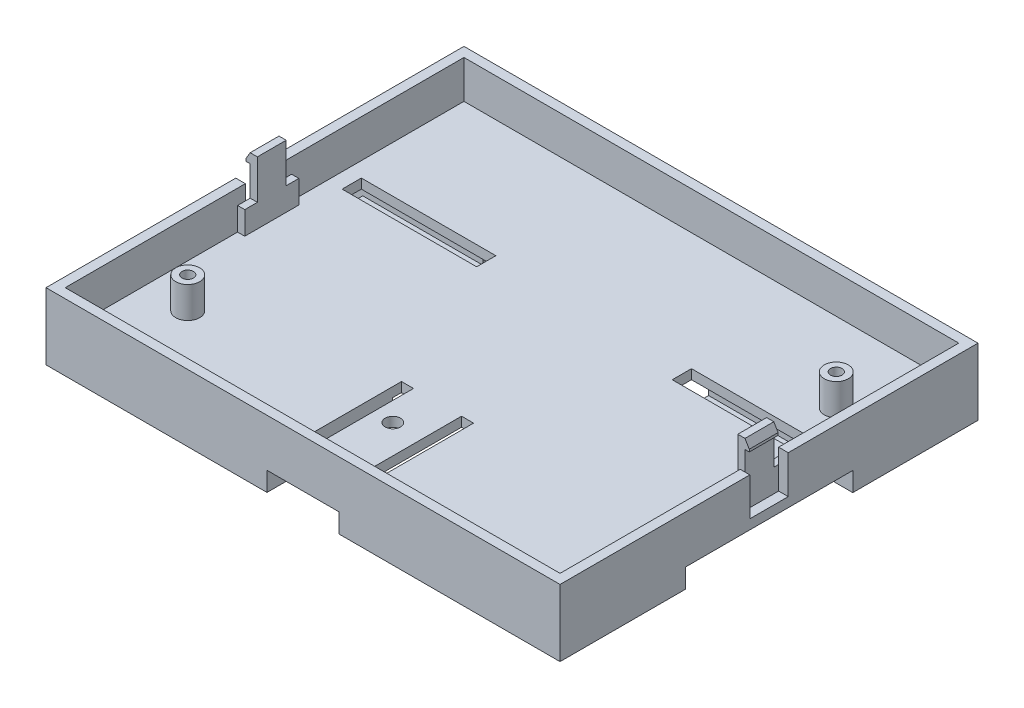
from build123d import *

# Parameters (mm, degrees)
SKETCH1_W               = 107
SKETCH1_H               = 87
BOSS_EXTRUDE1_DEPTH     = 13.92
SKETCH2_W               = 103
SKETCH2_H               = 83
CUT_EXTRUDE1_DEPTH      = 7.92
SKETCH3_R               = 2.5
BOSS_EXTRUDE2_DEPTH     = 6.5
CUT_EXTRUDE2_DEPTH      = 70.406241794
CUT_EXTRUDE2_DEPTH_BACK = 4
SKETCH4_R               = 1.2
SKETCH5_W               = 28
SKETCH5_H               = 4
CUT_EXTRUDE3_DEPTH      = 70.406241794
SKETCH6_W               = 2.5
SKETCH6_H               = 24
CUT_EXTRUDE4_DEPTH      = 70.406241794
SKETCH7_R               = 1.6
CUT_EXTRUDE6_DEPTH      = 70.406241794
SKETCH8_W               = 8
SKETCH8_H               = 7.92
CUT_EXTRUDE9_DEPTH      = 4
SKETCH9_W               = 1.5
SKETCH9_H               = 11.25
BOSS_EXTRUDE4_DEPTH     = 4.8
SKETCH10_W              = 1.5
SKETCH10_H              = 6
BOSS_EXTRUDE5_DEPTH     = 8.2
BOSS_EXTRUDE6_DEPTH     = 6
SKETCH12_W              = 103
SKETCH12_H              = 83
CUT_EXTRUDE10_DEPTH     = 4
SKETCH13_W              = 34.87
SKETCH13_H              = 4
CUT_EXTRUDE11_DEPTH     = 118.056610236
SKETCH14_W              = 28
SKETCH14_H              = 2.5
BOSS_EXTRUDE9_DEPTH     = 4
BOSS_EXTRUDE10_DEPTH    = 25
BOSS_EXTRUDE11_DEPTH    = 25
SKETCH16_W              = 15
SKETCH16_H              = 4
CUT_EXTRUDE12_DEPTH     = 104.885754558
BOSS_EXTRUDE12_DEPTH    = 4


with BuildPart() as part:
    # Sketch1 → Boss-Extrude1 (new body)
    with BuildSketch(Plane(origin=(0, 0, 0), x_dir=(1, 0, 0), z_dir=(0, 1, 0))):
        Rectangle(SKETCH1_W, SKETCH1_H)
    extrude(amount=BOSS_EXTRUDE1_DEPTH)

    # Sketch2 → Cut-Extrude1 (cut)
    with BuildSketch(Plane(origin=(0, 13.92, 0), x_dir=(1, 0, 0), z_dir=(0, 1, 0))):
        Rectangle(SKETCH2_W, SKETCH2_H)
    extrude(amount=-CUT_EXTRUDE1_DEPTH, mode=Mode.SUBTRACT)

    # Sketch3 → Boss-Extrude2 (add)
    with BuildSketch(Plane(origin=(0, 6, 0), x_dir=(1, 0, 0), z_dir=(0, 1, 0))):
        with Locations((-42.5, -25)):
            Circle(SKETCH3_R)
        with Locations((42.5, 25)):
            Circle(SKETCH3_R)
    extrude(amount=BOSS_EXTRUDE2_DEPTH)

    # Sketch4 → Cut-Extrude2 (cut, two sides: drawn at the far end of the back side and taken through both)
    with BuildSketch(Plane(origin=(0, 6, 0), x_dir=(1, 0, 0), z_dir=(0, 1, 0)).offset(-CUT_EXTRUDE2_DEPTH_BACK)):
        with Locations((-42.5, -25)):
            Circle(SKETCH4_R)
        with Locations((42.5, 25)):
            Circle(SKETCH4_R)
    extrude(amount=CUT_EXTRUDE2_DEPTH + CUT_EXTRUDE2_DEPTH_BACK, mode=Mode.SUBTRACT)

    # Sketch5 → Cut-Extrude3 (cut, through all)
    with BuildSketch(Plane(origin=(0, 6, 0), x_dir=(1, 0, 0), z_dir=(0, 1, 0))):
        with Locations((-34.36, 15)):
            Rectangle(SKETCH5_W, SKETCH5_H)
        with Locations((34.36, 15)):
            Rectangle(SKETCH5_W, SKETCH5_H)
    extrude(amount=-CUT_EXTRUDE3_DEPTH, mode=Mode.SUBTRACT)

    # Sketch6 → Cut-Extrude4 (cut, through all)
    with BuildSketch(Plane(origin=(0, 6, 0), x_dir=(1, 0, 0), z_dir=(0, 1, 0))):
        with Locations((6.25, -27.5)):
            Rectangle(SKETCH6_W, SKETCH6_H)
        with Locations((-6.25, -27.5)):
            Rectangle(SKETCH6_W, SKETCH6_H)
    extrude(amount=-CUT_EXTRUDE4_DEPTH, mode=Mode.SUBTRACT)

    # Sketch7 → Cut-Extrude6 (cut, through all)
    with BuildSketch(Plane(origin=(0, 6, 0), x_dir=(1, 0, 0), z_dir=(0, 1, 0))):
        with Locations((-1, -23.8)):
            Circle(SKETCH7_R)
    extrude(amount=-CUT_EXTRUDE6_DEPTH, mode=Mode.SUBTRACT)

    # Sketch8 → Cut-Extrude9 (cut)
    with BuildSketch(Plane.ZY.offset(53.5)):
        with Locations((0, 9.96)):
            Rectangle(SKETCH8_W, SKETCH8_H)
    cut_extrude9 = extrude(amount=-CUT_EXTRUDE9_DEPTH, mode=Mode.SUBTRACT)

    # Sketch9 → Boss-Extrude4 (add)
    with BuildSketch(Plane(origin=(0, 6, 0), x_dir=(1, 0, 0), z_dir=(0, 1, 0))):
        with Locations((-50.75, 0)):
            Rectangle(SKETCH9_W, SKETCH9_H)
    boss_extrude4 = extrude(amount=BOSS_EXTRUDE4_DEPTH)

    # Sketch10 → Boss-Extrude5 (add)
    with BuildSketch(Plane(origin=(0, 10.8, 0), x_dir=(1, 0, 0), z_dir=(0, 1, 0))):
        with Locations((-50.75, 0)):
            Rectangle(SKETCH10_W, SKETCH10_H)
    boss_extrude5 = extrude(amount=BOSS_EXTRUDE5_DEPTH)

    # Sketch11 → Boss-Extrude6 (add)
    with BuildSketch(Plane.XY.offset(3)):
        Polygon((-51.5, 19), (-52.4, 17.5), (-52.4, 17), (-51.5, 17), align=None)
    boss_extrude6 = extrude(amount=-BOSS_EXTRUDE6_DEPTH)

    # Mirror2: Cut-Extrude9, Boss-Extrude4, Boss-Extrude5, Boss-Extrude6 across plane
    add(cut_extrude9.mirror(Plane(origin=(0, 0, 0), x_dir=(0, 0, 1), z_dir=(1, 0, 0))), mode=Mode.SUBTRACT)
    add(boss_extrude4.mirror(Plane(origin=(0, 0, 0), x_dir=(0, 0, 1), z_dir=(1, 0, 0))))
    add(boss_extrude5.mirror(Plane(origin=(0, 0, 0), x_dir=(0, 0, 1), z_dir=(1, 0, 0))))
    add(boss_extrude6.mirror(Plane(origin=(0, 0, 0), x_dir=(0, 0, 1), z_dir=(1, 0, 0))))

    # Sketch12 → Cut-Extrude10 (cut)
    with BuildSketch(Plane.XZ):
        Rectangle(SKETCH12_W, SKETCH12_H)
    extrude(amount=-CUT_EXTRUDE10_DEPTH, mode=Mode.SUBTRACT)

    # Sketch13 → Cut-Extrude11 (cut, through all)
    with BuildSketch(Plane.ZY.offset(53.5)):
        with Locations((0, 2)):
            Rectangle(SKETCH13_W, SKETCH13_H)
    cut_extrude11 = extrude(amount=-CUT_EXTRUDE11_DEPTH, mode=Mode.SUBTRACT)

    # Sketch14 → Boss-Extrude9 (add)
    with BuildSketch(Plane(origin=(0, 4, 0), x_dir=(-1, 0, 0), z_dir=(0, -1, 0))):
        with Locations((37.5, 18.685)):
            Rectangle(SKETCH14_W, SKETCH14_H)
    boss_extrude9 = extrude(amount=BOSS_EXTRUDE9_DEPTH)

    # Sketch15 → Boss-Extrude10 (add)
    with BuildSketch(Plane(origin=(-23.5, 0, 0), x_dir=(0, 0, -1), z_dir=(1, 0, 0))):
        Polygon((17.435, 0), (14.935, 0), (14.935, 1), (16.435, 2.5), (17.435, 2.5), align=None)
    boss_extrude10 = extrude(amount=-BOSS_EXTRUDE10_DEPTH)

    # Mirror8: Cut-Extrude11, Boss-Extrude9, Boss-Extrude10 across plane
    add(cut_extrude11.mirror(Plane(origin=(0, 0, 0), x_dir=(0, 0, 1), z_dir=(1, 0, 0))), mode=Mode.SUBTRACT)
    add(boss_extrude9.mirror(Plane(origin=(0, 0, 0), x_dir=(0, 0, 1), z_dir=(1, 0, 0))))
    add(boss_extrude10.mirror(Plane(origin=(0, 0, 0), x_dir=(0, 0, 1), z_dir=(1, 0, 0))))

    # Sketch15<2> → Boss-Extrude11 (add)
    with BuildSketch(Plane(origin=(-23.5, 0, 0), x_dir=(0, 0, -1), z_dir=(1, 0, 0))):
        Polygon((17.435, 0), (14.935, 0), (14.935, 1), (16.435, 2.5), (17.435, 2.5), align=None)
    extrude(amount=-BOSS_EXTRUDE11_DEPTH)

    # Sketch16 → Cut-Extrude12 (cut, through all)
    with BuildSketch(Plane.XY.offset(43.5)):
        with Locations((0, 2)):
            Rectangle(SKETCH16_W, SKETCH16_H)
    cut_extrude12 = extrude(amount=-CUT_EXTRUDE12_DEPTH, mode=Mode.SUBTRACT)

    # Sketch18 → Boss-Extrude12 (add)
    with BuildSketch(Plane(origin=(0, 4, 0), x_dir=(-1, 0, 0), z_dir=(0, -1, 0))):
        Polygon((7.5, -41.5), (7.5, -17.37), (39.5, -17.37), (43.5, -19.017333388), (42.75, -20.838458378), (39.5, -19.5), (10.5, -19.5), (10.5, -41.5), align=None)
    boss_extrude12 = extrude(amount=BOSS_EXTRUDE12_DEPTH)

    # Mirror9: Cut-Extrude12, Boss-Extrude12 across plane
    add(cut_extrude12.mirror(Plane(origin=(0, 0, 0), x_dir=(0, 0, 1), z_dir=(1, 0, 0))), mode=Mode.SUBTRACT)
    add(boss_extrude12.mirror(Plane(origin=(0, 0, 0), x_dir=(0, 0, 1), z_dir=(1, 0, 0))))


solid = part.part
